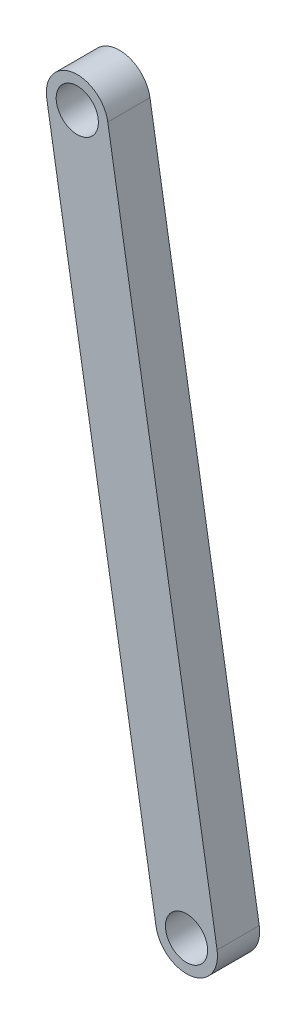
from build123d import *

# Parameters (mm, degrees)
ESQUISSE1_R        = 1.5
BOSS_EXTRU_1_DEPTH = 3


with BuildPart() as part:
    # Esquisse1 → Boss.-Extru.1 (new body)
    with BuildSketch(Plane.XY):
        with BuildLine():
            Line((2.170661543, 0.358090025), (9.940661543, -46.741909975))
            ThreePointArc((9.940661543, -46.741909975), (8.128090025, -49.270661543), (5.599338457, -47.458090025))
            Line((5.599338457, -47.458090025), (-2.170661543, -0.358090025))
            ThreePointArc((-2.170661543, -0.358090025), (-0.358090025, 2.170661543), (2.170661543, 0.358090025))
        make_face()
        Circle(ESQUISSE1_R, mode=Mode.SUBTRACT)
        with Locations((7.77, -47.1)):
            Circle(ESQUISSE1_R, mode=Mode.SUBTRACT)
    extrude(amount=BOSS_EXTRU_1_DEPTH)


solid = part.part
